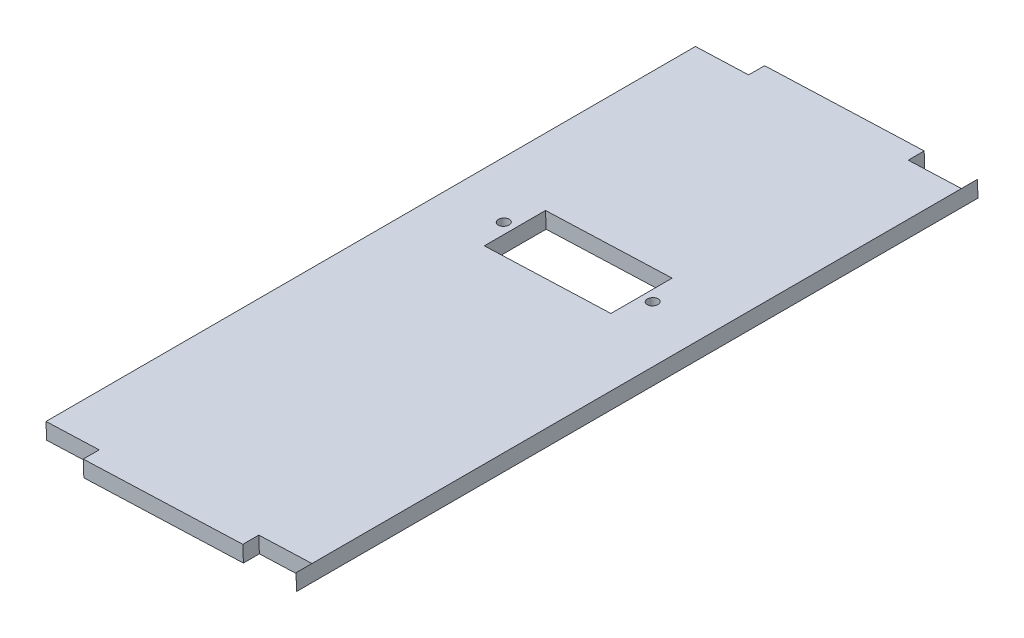
from build123d import *

# Parameters (mm, degrees)
EXTRUDE_1_DEPTH     = 128
SKETCH_3_W          = 10.000026291
SKETCH_3_H          = 3
CUT_EXTRUDE_1_DEPTH = 891.48631143
SKETCH_4_R          = 1
SKETCH_4_W          = 23.8
SKETCH_4_H          = 11.5
CUT_EXTRUDE_2_DEPTH = 891.48631143


with BuildPart() as part:
    # 草图2 → 凸台-拉伸1 (new body)
    with BuildSketch(Plane(origin=(0, 0, 762.01), x_dir=(-1, 0, 0), z_dir=(0, 0, -1))):
        Polygon((-21.370258024, -5.639890041), (28.594871448, -7.506929626), (28.475974915, -10.504572636), (-21.489154557, -8.637533051), align=None)
    extrude(amount=-EXTRUDE_1_DEPTH)

    # 草图3 → 切除-拉伸1 (cut, through all)
    with BuildSketch(Plane(origin=(0.240248379, -6.429451979, 0), x_dir=(0.9993025894470269, 0.03734079169577059, 0), z_dir=(-0.03734079169577059, 0.9993025894470269, 0))):
        with Locations((-23.855256925, -763.51)):
            Rectangle(SKETCH_3_W, SKETCH_3_H)
        with Locations((16.144743076, -763.51)):
            Rectangle(SKETCH_3_W, SKETCH_3_H)
        with Locations((-23.855256925, -888.51)):
            Rectangle(SKETCH_3_W, SKETCH_3_H)
        with Locations((16.144743076, -888.51)):
            Rectangle(SKETCH_3_W, SKETCH_3_H)
    extrude(amount=-CUT_EXTRUDE_1_DEPTH, mode=Mode.SUBTRACT)

    # 草图4 → 切除-拉伸2 (cut, through all)
    with BuildSketch(Plane(origin=(0.240248379, -6.429451979, 0), x_dir=(0.9993025894470269, 0.03734079169577059, 0), z_dir=(-0.03734079169577059, 0.9993025894470269, 0))):
        with Locations(Location((10.144756221, -812.01, 0), (0, 0, 180))):
            Circle(SKETCH_4_R)
        with Locations((-17.855243779, -812.01)):
            Circle(SKETCH_4_R)
        with Locations((-3.855243779, -812.01)):
            Rectangle(SKETCH_4_W, SKETCH_4_H)
    extrude(amount=-CUT_EXTRUDE_2_DEPTH, mode=Mode.SUBTRACT)


solid = part.part
